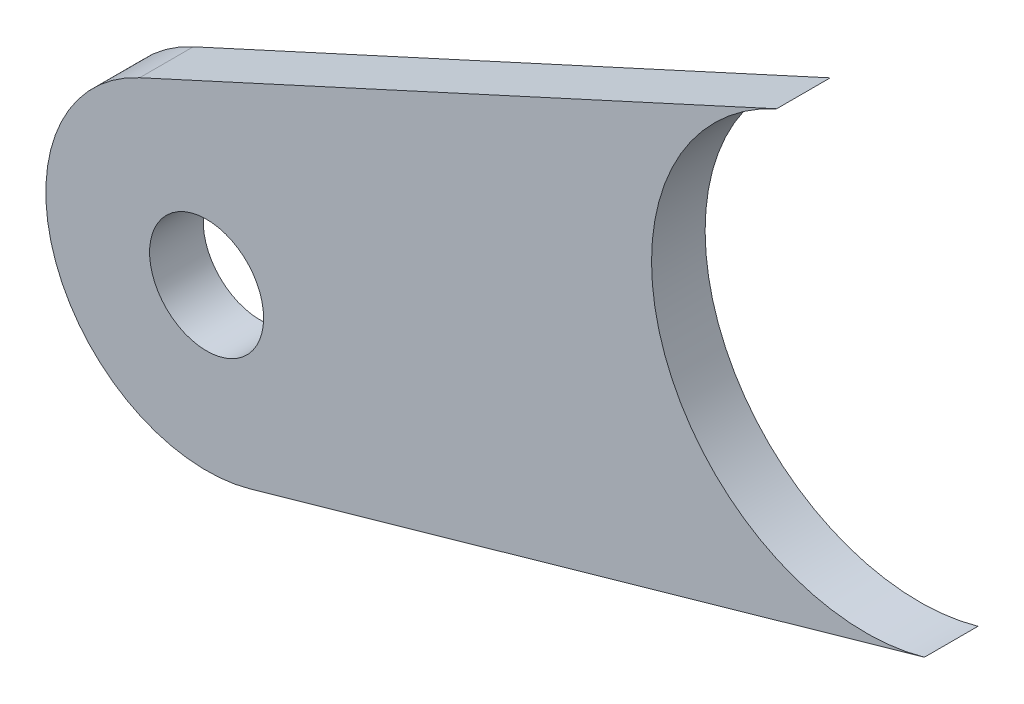
from build123d import *

# Parameters (mm, degrees)
SKETCH2_R           = 3.3782
BOSS_EXTRUDE1_DEPTH = 3.175


with BuildPart() as part:
    # Sketch2 → Boss-Extrude1 (new body)
    with BuildSketch(Plane.XY):
        with BuildLine():
            ThreePointArc((97.599900636, 8.660718944), (92.626573288, -3.292440377), (104.165601068, -9.162946366))
            Line((104.165601068, -9.162946366), (144.095161779, 2.172186968))
            ThreePointArc((144.095161779, 2.172186968), (128.709791406, 9.999528287), (135.340894537, 25.937074048))
            Line((135.340894537, 25.937074048), (97.599900636, 8.660718944))
        make_face()
        with Locations((101.56444, 0)):
            Circle(SKETCH2_R, mode=Mode.SUBTRACT)
    extrude(amount=BOSS_EXTRUDE1_DEPTH)


solid = part.part
